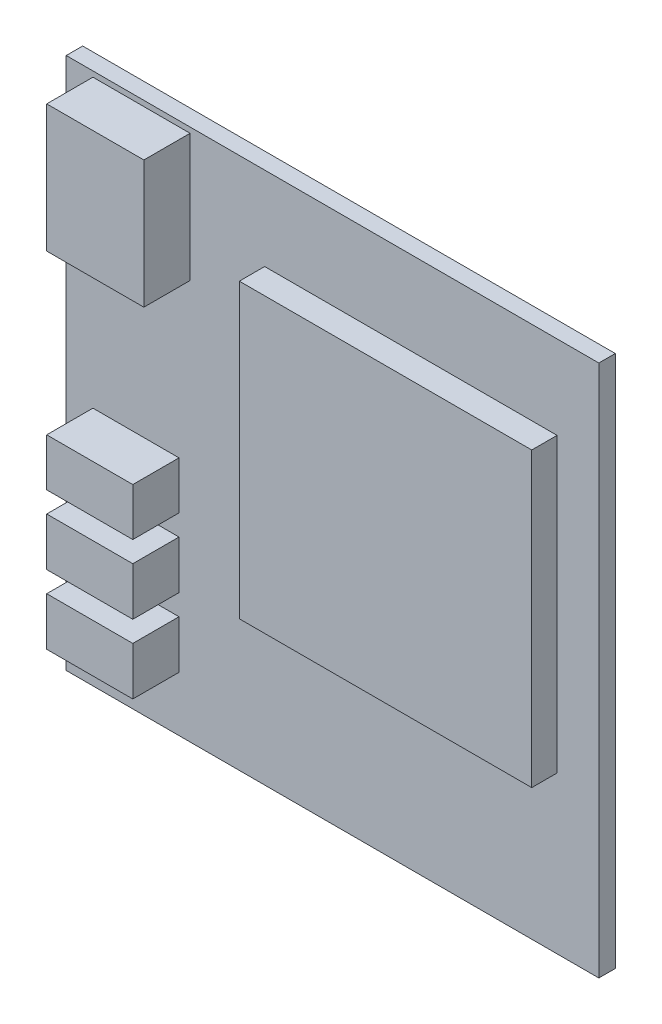
from build123d import *

# Parameters (mm, degrees)
SKETCH1_W           = 51
SKETCH1_H           = 51
SKETCH1_W_2         = 28
SKETCH1_H_2         = 28
SKETCH1_W_3         = 9.30278776
SKETCH1_H_3         = 12.209946987
SKETCH1_W_4         = 8.24332
SKETCH1_H_4         = 4.56356538
SKETCH1_H_5         = 4.61067604
BOSS_EXTRUDE1_DEPTH = 1.5748
SKETCH1_2_W         = 28
SKETCH1_2_H         = 28
BOSS_EXTRUDE2_DEPTH = 4
SKETCH1_3_W         = 9.30278776
SKETCH1_3_H         = 12.209946987
SKETCH1_3_W_2       = 8.24332
SKETCH1_3_H_2       = 4.56356538
SKETCH1_3_H_3       = 4.61067604
BOSS_EXTRUDE3_DEPTH = 6


with BuildPart() as part:
    # Sketch1 → Boss-Extrude1 (new body)
    with BuildSketch(Plane.XY):
        Rectangle(SKETCH1_W, SKETCH1_H)
        with Locations((7.5, 3.5)):
            Rectangle(SKETCH1_W_2, SKETCH1_H_2, mode=Mode.SUBTRACT)
        with Locations((-18.29281594, 18.874000471)):
            Rectangle(SKETCH1_W_3, SKETCH1_H_3, mode=Mode.SUBTRACT)
        with Locations((-18.82254982, -4.74850311)):
            Rectangle(SKETCH1_W_4, SKETCH1_H_4, mode=Mode.SUBTRACT)
        with Locations((-18.82254982, -11.33562382)):
            Rectangle(SKETCH1_W_4, SKETCH1_H_5, mode=Mode.SUBTRACT)
        with Locations((-18.82254982, -17.94629986)):
            Rectangle(SKETCH1_W_4, SKETCH1_H_5, mode=Mode.SUBTRACT)
    extrude(amount=BOSS_EXTRUDE1_DEPTH)

    # Sketch1<2> → Boss-Extrude2 (add)
    with BuildSketch(Plane.XY):
        with Locations((7.5, 3.5)):
            Rectangle(SKETCH1_2_W, SKETCH1_2_H)
    extrude(amount=BOSS_EXTRUDE2_DEPTH)

    # Sketch1<3> → Boss-Extrude3 (add)
    with BuildSketch(Plane.XY):
        with Locations((-18.29281594, 18.874000471)):
            Rectangle(SKETCH1_3_W, SKETCH1_3_H)
        with Locations((-18.82254982, -4.74850311)):
            Rectangle(SKETCH1_3_W_2, SKETCH1_3_H_2)
        with Locations((-18.82254982, -11.33562382)):
            Rectangle(SKETCH1_3_W_2, SKETCH1_3_H_3)
        with Locations((-18.82254982, -17.94629986)):
            Rectangle(SKETCH1_3_W_2, SKETCH1_3_H_3)
    extrude(amount=BOSS_EXTRUDE3_DEPTH)


solid = part.part
